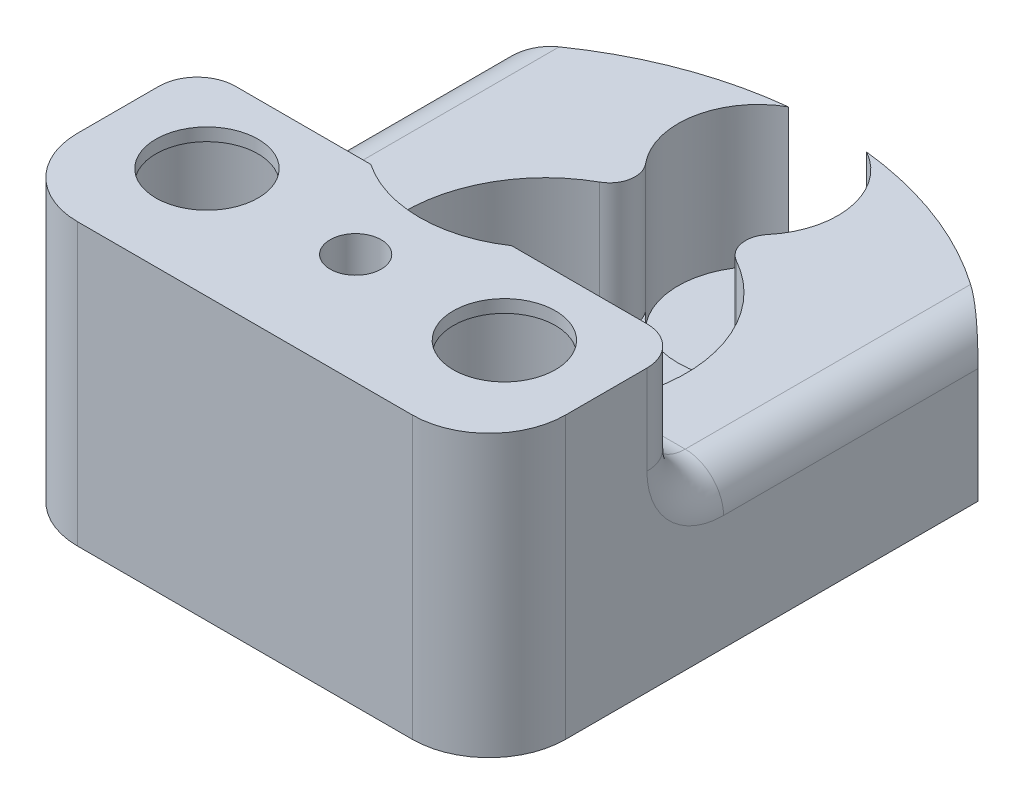
from build123d import *

# Parameters (mm, degrees)
SKETCH1_R           = 34.445
BOSS_EXTRUDE1_DEPTH = 22
SKETCH15_R          = 34.445
CUT_EXTRUDE2_DEPTH  = 54.450126754
CUT_EXTRUDE4_START  = -1
SKETCH17_R          = 6.2
CUT_EXTRUDE4_DEPTH  = 20
SKETCH18_R          = 7.25
CUT_EXTRUDE5_DEPTH  = 41.489614217
SKETCH19_R          = 6.25
CUT_EXTRUDE7_DEPTH  = 21
SKETCH20_R          = 9.845995641
CUT_EXTRUDE9_DEPTH  = 10
FILLET12_R          = 6
SKETCH23_R          = 4
SKETCH23_R_2        = 2
CUT_EXTRUDE10_DEPTH = 41.489614217
CUT_EXTRUDE11_START = -12
CUT_EXTRUDE11_DEPTH = 29.489614217
FILLET19_R          = 3
SKETCH25_R          = 11
CUT_EXTRUDE12_DEPTH = 10
FILLET20_R          = 2


with BuildPart() as part:
    # Sketch1 → Boss-Extrude1 (new body)
    with BuildSketch(Plane(origin=(0, 0, 0), x_dir=(1, 0, 0), z_dir=(0, 1, 0))):
        with Locations(Location((0, 0, 0), (0, 0, 270))):
            Circle(SKETCH1_R)
    extrude(amount=BOSS_EXTRUDE1_DEPTH)

    # Sketch15 → Cut-Extrude2 (cut, through all)
    with BuildSketch(Plane(origin=(0, 22, 0), x_dir=(1, 0, 0), z_dir=(0, 1, 0))):
        Circle(SKETCH15_R)
        with BuildLine():
            Line((-19.109582045, 20.616901016), (-19.109582045, -17.678671312))
            Line((-19.109582045, -17.678671312), (19.109582045, -17.678671312))
            Line((19.109582045, -17.678671312), (19.109582045, 20.616901016))
            ThreePointArc((19.109582045, 20.616901016), (0, 28.111078483), (-19.109582045, 20.616901016))
        make_face(mode=Mode.SUBTRACT)
    extrude(amount=-CUT_EXTRUDE2_DEPTH, mode=Mode.SUBTRACT)

    # Sketch17 → Cut-Extrude4 (cut)
    with BuildSketch(Plane(origin=(0, 22, 0), x_dir=(1, 0, 0), z_dir=(0, 1, 0)).offset(CUT_EXTRUDE4_START)):
        with Locations(Location((-11.644122412, -9.008465082, 0), (0, 0, 270))):
            Circle(SKETCH17_R)
        with Locations(Location((11.644122412, -9.008465082, 0), (0, 0, 90))):
            Circle(SKETCH17_R)
    extrude(amount=-CUT_EXTRUDE4_DEPTH, mode=Mode.SUBTRACT)

    # Sketch18 → Cut-Extrude5 (cut, through all)
    with BuildSketch(Plane(origin=(0, 22, 0), x_dir=(1, 0, 0), z_dir=(0, 1, 0))):
        with Locations(Location((0, 5.846291401, 0), (0, 0, 270))):
            Circle(SKETCH18_R)
    extrude(amount=-CUT_EXTRUDE5_DEPTH, mode=Mode.SUBTRACT)

    # Sketch19 → Cut-Extrude7 (cut)
    with BuildSketch(Plane(origin=(0, 22, 0), x_dir=(1, 0, 0), z_dir=(0, 1, 0))):
        with Locations((0, 22.497935332)):
            Circle(SKETCH19_R)
    extrude(amount=-CUT_EXTRUDE7_DEPTH, mode=Mode.SUBTRACT)

    # Sketch20 → Cut-Extrude9 (cut)
    with BuildSketch(Plane(origin=(0, 22, 0), x_dir=(1, 0, 0), z_dir=(0, 1, 0))):
        with Locations(Location((0, 5.846291401, 0), (0, 0, 270))):
            Circle(SKETCH20_R)
    extrude(amount=-CUT_EXTRUDE9_DEPTH, mode=Mode.SUBTRACT)

    # Fillet12
    fillet12_edges = [part.edges().sort_by_distance(p)[0] for p in [
        (-19.109582045, 11, 17.678671312),
        (19.109582045, 11, 17.678671312),
    ]]
    fillet(fillet12_edges, radius=FILLET12_R)

    # Sketch23 → Cut-Extrude10 (cut, through all)
    with BuildSketch(Plane(origin=(0, 22, 0), x_dir=(1, 0, 0), z_dir=(0, 1, 0))):
        with Locations(Location((-11.644122412, -9.008465082, 0), (0, 0, 270))):
            Circle(SKETCH23_R)
        with Locations(Location((11.644122412, -9.008465082, 0), (0, 0, 270))):
            Circle(SKETCH23_R)
        with Locations(Location((0, -9.008465082, 0), (0, 0, 270))):
            Circle(SKETCH23_R_2)
    extrude(amount=-CUT_EXTRUDE10_DEPTH, mode=Mode.SUBTRACT)

    # Sketch24 → Cut-Extrude11 (cut, through all)
    with BuildSketch(Plane.XZ.offset(CUT_EXTRUDE11_START)):
        with BuildLine():
            Line((-19.109582045, -20.616901016), (-19.109582045, 2.30978602))
            Line((-19.109582045, 2.30978602), (19.109582045, 2.30978602))
            Line((19.109582045, 2.30978602), (19.109582045, -20.616901016))
            ThreePointArc((19.109582045, -20.616901016), (0, -28.111078483), (-19.109582045, -20.616901016))
        make_face()
    extrude(amount=-CUT_EXTRUDE11_DEPTH, mode=Mode.SUBTRACT)

    # Fillet19
    fillet19_edges = [part.edges().sort_by_distance(p)[0] for p in [
        (-19.109582045, 17, 2.30978602),
        (12.31259954, 12, 2.30978602),
        (-12.31259954, 12, 2.30978602),
        (-19.109582045, 12, -9.153557498),
        (19.109582045, 12, -9.153557498),
        (19.109582045, 17, 2.30978602),
    ]]
    fillet(fillet19_edges, radius=FILLET19_R)

    # Sketch25 → Cut-Extrude12 (cut)
    with BuildSketch(Plane(origin=(0, 12, 0), x_dir=(1, 0, 0), z_dir=(0, 1, 0))):
        with Locations((0, 5.846291401)):
            Circle(SKETCH25_R)
    extrude(amount=-CUT_EXTRUDE12_DEPTH, mode=Mode.SUBTRACT)

    # Fillet20
    fillet20_edges = [part.edges().sort_by_distance(p)[0] for p in [
        (2.158391198, 7, -16.632456031),
        (-2.158391198, 7, -16.632456031),
    ]]
    fillet(fillet20_edges, radius=FILLET20_R)


solid = part.part
